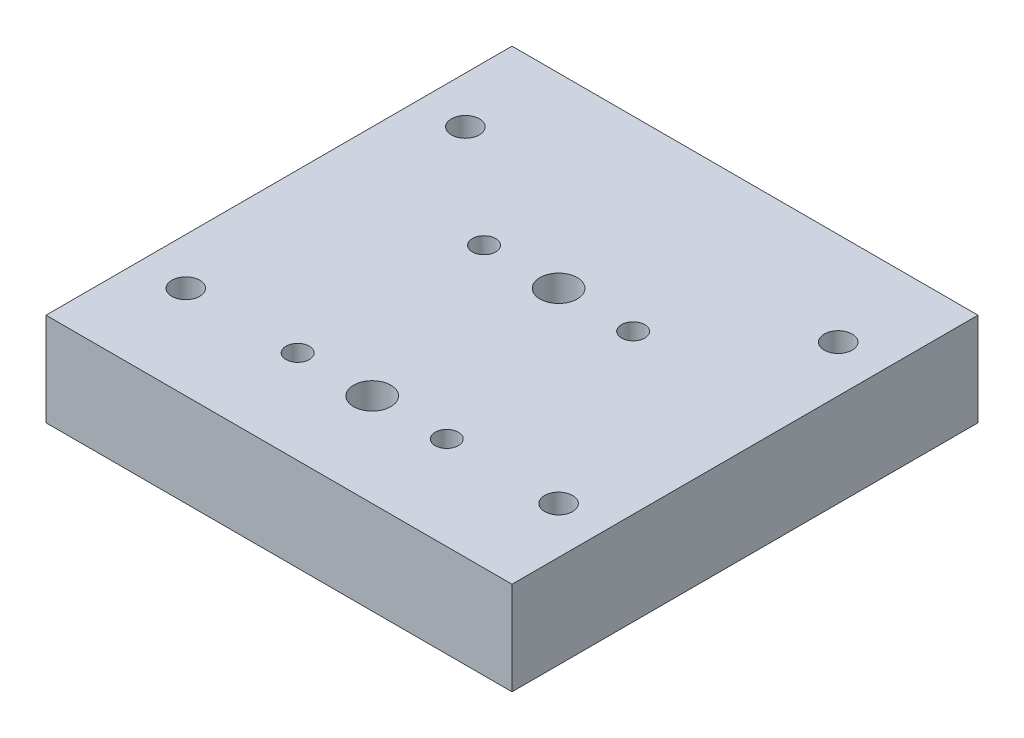
from build123d import *

# Parameters (mm, degrees)
SKETCH_1_W          = 100
SKETCH_1_H          = 100
EXTRUDE_1_DEPTH     = 20
SKETCH_2_R          = 3
SKETCH_2_R_2        = 2.5
SKETCH_2_R_3        = 4
CUT_EXTRUDE_1_DEPTH = 20


with BuildPart() as part:
    # Эскиз1 → Бобышка-Вытянуть1 (new body)
    with BuildSketch(Plane(origin=(0, 0, 0), x_dir=(1, 0, 0), z_dir=(0, 1, 0))):
        with Locations((50, 50)):
            Rectangle(SKETCH_1_W, SKETCH_1_H)
    extrude(amount=EXTRUDE_1_DEPTH)

    # Эскиз2 → Вырез-Вытянуть1 (cut)
    with BuildSketch(Plane(origin=(0, 20, 0), x_dir=(1, 0, 0), z_dir=(0, 1, 0))):
        with Locations(Location((10, 80, 0), (0, 0, 270))):
            Circle(SKETCH_2_R)
        with Locations(Location((90, 80, 0), (0, 0, 270))):
            Circle(SKETCH_2_R)
        with Locations(Location((34, 60, 0), (0, 0, 270))):
            Circle(SKETCH_2_R_2)
        with Locations(Location((50, 20, 0), (0, 0, 270))):
            Circle(SKETCH_2_R_3)
        with Locations(Location((66, 60, 0), (0, 0, 270))):
            Circle(SKETCH_2_R_2)
        with Locations(Location((10, 20, 0), (0, 0, 270))):
            Circle(SKETCH_2_R)
        with Locations(Location((50, 60, 0), (0, 0, 270))):
            Circle(SKETCH_2_R_3)
        with Locations(Location((90, 20, 0), (0, 0, 270))):
            Circle(SKETCH_2_R)
        with Locations(Location((34, 20, 0), (0, 0, 270))):
            Circle(SKETCH_2_R_2)
        with Locations(Location((66, 20, 0), (0, 0, 270))):
            Circle(SKETCH_2_R_2)
    extrude(amount=-CUT_EXTRUDE_1_DEPTH, mode=Mode.SUBTRACT)


solid = part.part
